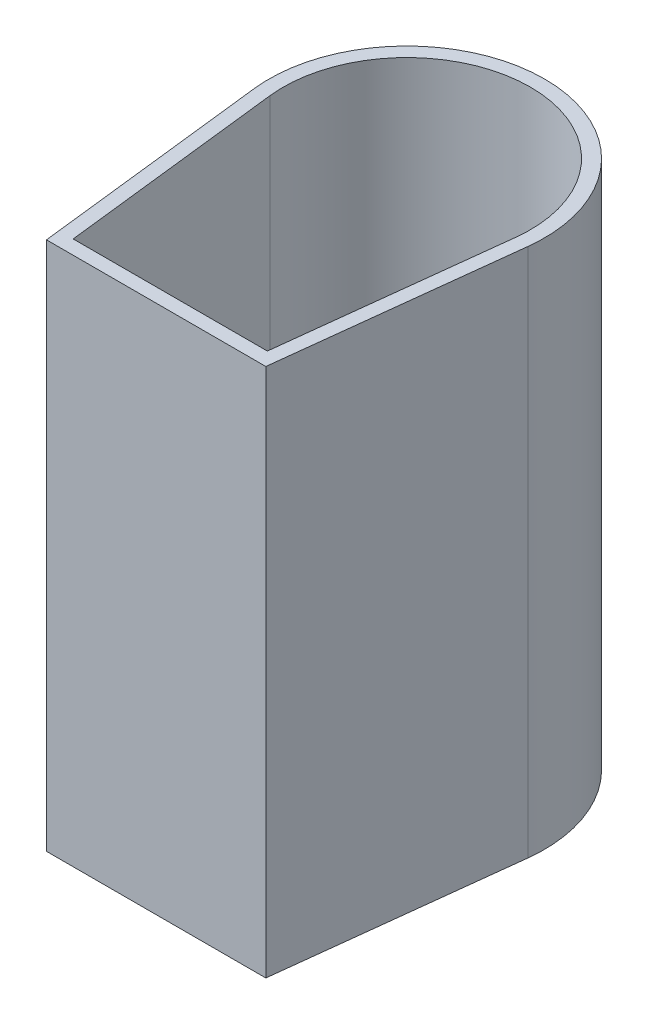
from build123d import *

# Parameters (mm, degrees)
BOSS_EXTRUDE1_DEPTH = 150
BOSS_EXTRUDE2_DEPTH = 5
CUT_EXTRUDE2_REACH  = 172.476
SKETCH6_R           = 6.25
CUT_EXTRUDE3_REACH  = 172.476
SKETCH7_R           = 3.25


with BuildPart() as part:
    # Sketch3 → Boss-Extrude1 (new body)
    with BuildSketch(Plane(origin=(0, 0, 0), x_dir=(1, 0, 0), z_dir=(0, 1, 0))):
        with BuildLine():
            Line((-31.064919271, -71), (-38.742847032, -4.471219502))
            ThreePointArc((-38.742847032, -4.471219502), (0, 39), (38.742847032, -4.471219502))
            Line((38.742847032, -4.471219502), (31.064919271, -71))
            Line((31.064919271, -71), (0, -71))
            Line((0, -71), (-31.064919271, -71))
        make_face()
        with BuildLine():
            Line((0, -67), (-27.5, -67))
            Line((-27.5, -67), (-34.769221696, -4.012632886))
            ThreePointArc((-34.769221696, -4.012632886), (0, 35), (34.769221696, -4.012632886))
            Line((34.769221696, -4.012632886), (27.5, -67))
            Line((27.5, -67), (0, -67))
        make_face(mode=Mode.SUBTRACT)
    extrude(amount=BOSS_EXTRUDE1_DEPTH)

    # Sketch4 → Boss-Extrude2 (add)
    with BuildSketch(Plane.XZ):
        with BuildLine():
            Line((-27.5, 67), (-34.769221696, 4.012632886))
            ThreePointArc((-34.769221696, 4.012632886), (0, -35), (34.769221696, 4.012632886))
            Line((34.769221696, 4.012632886), (27.5, 67))
            Line((27.5, 67), (-27.5, 67))
        make_face()
    extrude(amount=-BOSS_EXTRUDE2_DEPTH)

    # Sketch6 → Cut-Extrude2 (cut, up to next)
    with BuildSketch(Plane.XZ, mode=Mode.PRIVATE) as cut_extrude2_sk1:
        with Locations(Location((0, 0, 0), (0, 0, 270))):
            Circle(SKETCH6_R)
    cut_extrude2_tool1 = extrude(cut_extrude2_sk1.sketch, amount=-CUT_EXTRUDE2_REACH, mode=Mode.PRIVATE) & part.part
    add(cut_extrude2_tool1.solids().sort_by_distance((0, 0, 0))[0], mode=Mode.SUBTRACT)

    # Sketch7 → Cut-Extrude3 (cut, up to next)
    with BuildSketch(Plane.XZ, mode=Mode.PRIVATE) as cut_extrude3_sk1:
        with Locations(Location((24, 0, 0), (0, 0, 270))):
            Circle(SKETCH7_R)
    cut_extrude3_tool1 = extrude(cut_extrude3_sk1.sketch, amount=-CUT_EXTRUDE3_REACH, mode=Mode.PRIVATE) & part.part
    # Sketch7 → Cut-Extrude3 (cut, up to next)
    with BuildSketch(Plane.XZ, mode=Mode.PRIVATE) as cut_extrude3_sk2:
        with Locations(Location((-24, 0, 0), (0, 0, 270))):
            Circle(SKETCH7_R)
    cut_extrude3_tool2 = extrude(cut_extrude3_sk2.sketch, amount=-CUT_EXTRUDE3_REACH, mode=Mode.PRIVATE) & part.part
    add(cut_extrude3_tool1.solids().sort_by_distance((24, 0, 0))[0], mode=Mode.SUBTRACT)
    add(cut_extrude3_tool2.solids().sort_by_distance((-24, 0, 0))[0], mode=Mode.SUBTRACT)


solid = part.part
